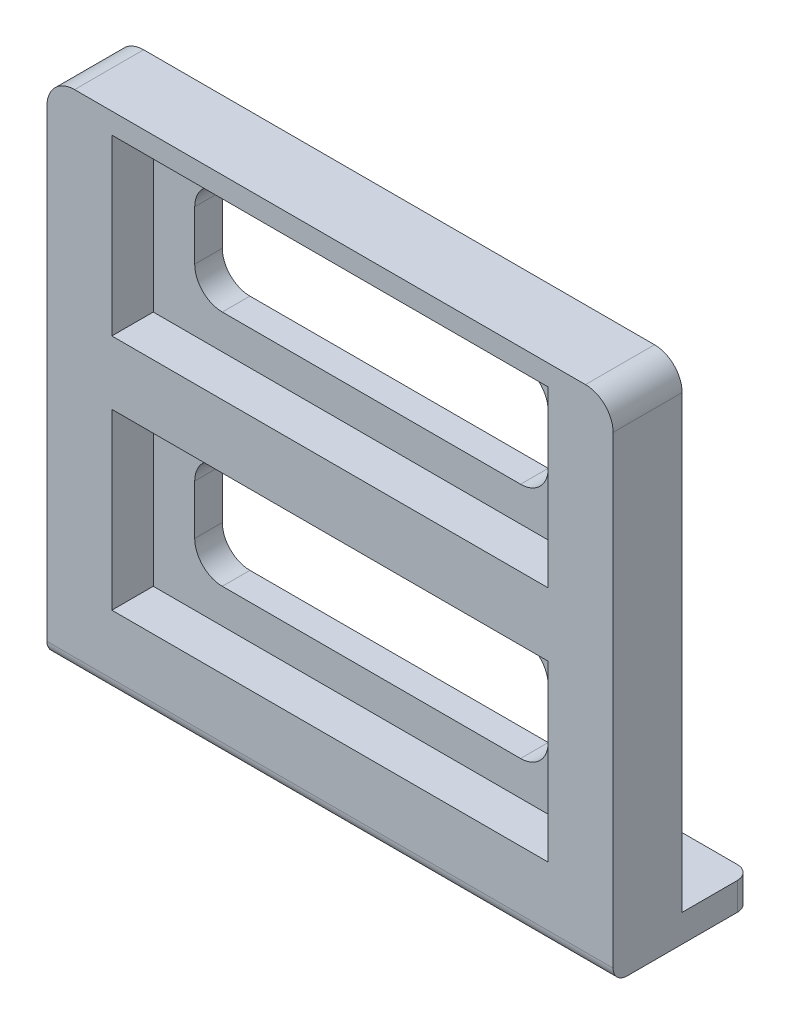
from build123d import *

# Parameters (mm, degrees)
SKETCH1_W                   = 42
SKETCH1_H                   = 40.2
BOSS_EXTRUDE1_DEPTH         = 5
SKETCH2_W                   = 31.6
SKETCH2_H                   = 12.6
CUT_EXTRUDE1_DEPTH          = 3
SKETCH3_W                   = 25.6
SKETCH3_H                   = 7.6
CUT_EXTRUDE2_DEPTH          = 3
CUT_EXTRUDE3_DEPTH          = 5
FILLET1_R                   = 2
SKETCH9_W                   = 41
SKETCH9_H                   = 2
BOSS_EXTRUDE3_DEPTH         = 10
FILLET2_R                   = 1
TAP_DRILL_FOR_M3_TAP1_D     = 2.5
TAP_DRILL_FOR_M3_TAP1_DEPTH = 2
TAP_DRILL_FOR_M3_TAP1_TIP   = 0.751075774
FILLET3_R                   = 1


with BuildPart() as part:
    # Sketch1 → Boss-Extrude1 (new body)
    with BuildSketch(Plane.XY):
        with Locations((-0.5, 2.1)):
            Rectangle(SKETCH1_W, SKETCH1_H)
    extrude(amount=BOSS_EXTRUDE1_DEPTH)

    # Sketch2 → Cut-Extrude1 (cut)
    with BuildSketch(Plane.XY.offset(5)):
        with Locations((-1, 10.7)):
            Rectangle(SKETCH2_W, SKETCH2_H)
        with Locations((-1, -6.5)):
            Rectangle(SKETCH2_W, SKETCH2_H)
    extrude(amount=-CUT_EXTRUDE1_DEPTH, mode=Mode.SUBTRACT)

    # Sketch3 → Cut-Extrude2 (cut)
    with BuildSketch(Plane.XY.offset(2)):
        with Locations((-1, 10.7)):
            Rectangle(SKETCH3_W, SKETCH3_H)
        with Locations((-1, -6.5)):
            Rectangle(SKETCH3_W, SKETCH3_H)
    extrude(amount=-CUT_EXTRUDE2_DEPTH, mode=Mode.SUBTRACT)

    # Sketch4 → Cut-Extrude3 (cut)
    with BuildSketch(Plane(origin=(0, 0, 0), x_dir=(-1, 0, 0), z_dir=(0, 0, -1))):
        Polygon((-15.288574128, 22.2), (-20.5, 22.2), (-20.5, 16.307906388), (-20.5, -16.83473783), (-20.5, -18), (-15.288574128, -18), (16.313805872, -18), (21.5, -18), (21.5, -16.83473783), (21.5, -16.1), (-19.5, -16.1), (-19.5, 18.5), (21.5, 18.5), (21.5, 22.2), (16.313805872, 22.2), align=None)
    extrude(amount=-CUT_EXTRUDE3_DEPTH, mode=Mode.SUBTRACT)

    # Fillet1
    fillet1_edges = [part.edges().sort_by_distance(p)[0] for p in [
        (-13.8, 6.9, 1),
        (-13.8, 14.5, 1),
        (11.8, 14.5, 1),
        (11.8, 6.9, 1),
        (-13.8, -10.3, 1),
        (-13.8, -2.7, 1),
        (11.8, -2.7, 1),
        (11.8, -10.3, 1),
        (19.5, 18.5, 2.5),
        (-21.5, 18.5, 2.5),
    ]]
    fillet(fillet1_edges, radius=FILLET1_R)

    # Sketch9 → Boss-Extrude3 (add)
    with BuildSketch(Plane.XY.offset(5)):
        with Locations((-1, -17.1)):
            Rectangle(SKETCH9_W, SKETCH9_H)
    extrude(amount=-BOSS_EXTRUDE3_DEPTH)

    # Fillet2
    fillet2_edges = [part.edges().sort_by_distance(p)[0] for p in [
        (-1, -18.1, 5),
    ]]
    fillet(fillet2_edges, radius=FILLET2_R)

    # Tap Drill for M3 Tap1
    with Locations(Plane(origin=(0, -16.1, 0), x_dir=(1, 0, 0), z_dir=(0, 1, 0))):
        with Locations((14, 2.87743455), (4, 2.87743455), (-6, 2.87743455), (-16, 2.87743455)):
            Hole(TAP_DRILL_FOR_M3_TAP1_D / 2, depth=TAP_DRILL_FOR_M3_TAP1_DEPTH)
            with Locations((0, 0, -(TAP_DRILL_FOR_M3_TAP1_DEPTH + TAP_DRILL_FOR_M3_TAP1_TIP / 2))):  # 118° drill point
                Cone(0, TAP_DRILL_FOR_M3_TAP1_D / 2, TAP_DRILL_FOR_M3_TAP1_TIP, mode=Mode.SUBTRACT)

    # Fillet3
    fillet3_edges = [part.edges().sort_by_distance(p)[0] for p in [
        (-21.5, -17.1, -5),
        (19.5, -17.1, -5),
    ]]
    fillet(fillet3_edges, radius=FILLET3_R)


solid = part.part
